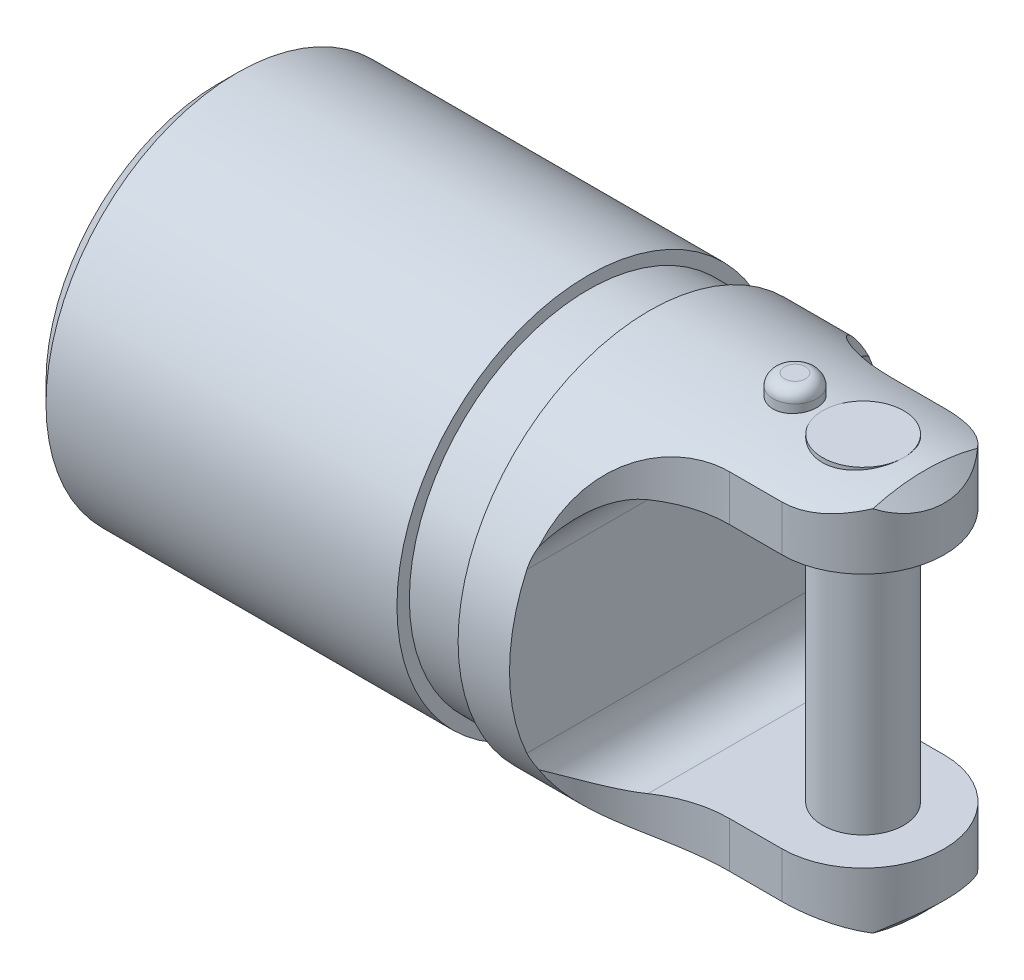
from build123d import *

# Parameters (mm, degrees)
SKETCH1_W               = 48.26
SKETCH1_H               = 12.7
CHAMFER1_SIZE           = 1.27
EXTRUDE1_DEPTH          = 47.473367709
EXTRUDE1_DEPTH_BACK     = 47.473367709
SKETCH4_R               = 6.35
EXTRUDE4_DEPTH          = 30.1625
EXTRUDE3_DEPTH          = 47.473367764
EXTRUDE3_DEPTH_BACK     = 47.473367764
EXTRUDE6_DEPTH          = 47.473367764
EXTRUDE6_DEPTH_BACK     = 47.473367764
SKETCH6_R               = 2.69875
SKETCH21_R              = 1.4605
BOSS_EXTRUDE1_DEPTH     = 13.97
FILLET1_R               = 0.762
CUT_EXTRUDE3_DEPTH      = 47.836362066
CUT_EXTRUDE3_DEPTH_BACK = 47.836362066
SKETCH23_W              = 4.064
SKETCH23_H              = 0.8255
SKETCH14_R              = 2.69875
EXTRUDE14_DEPTH         = 12.7


with BuildPart() as part:
    # Sketch1 → Revolve1 (revolve)
    with BuildSketch(Plane(origin=(0, 0, 0), x_dir=(1, 0, 0), z_dir=(0, 1, 0)), mode=Mode.PRIVATE) as revolve1_sk:
        with Locations((-18.7325, 6.35)):
            Rectangle(SKETCH1_W, SKETCH1_H)
    revolve(revolve1_sk.sketch.rotate(Axis((-42.8625, 0, 0), (1, 0, 0)), 180), axis=Axis((-42.8625, 0, 0), (1, 0, 0)))

    # Chamfer1
    chamfer1_edges = [part.edges().sort_by_distance(p)[0] for p in [
        (5.3975, 0, -12.7),
        (-42.8625, 0, -12.7),
    ]]
    chamfer(chamfer1_edges, length=CHAMFER1_SIZE)

    # Sketch2 → Extrude1 (cut, two sides: drawn at the far end of the back side and taken through both)
    with BuildSketch(Plane(origin=(0, 0, 0), x_dir=(1, 0, 0), z_dir=(0, 1, 0)).offset(-EXTRUDE1_DEPTH_BACK)):
        with BuildLine():
            Line((-10.795, 12.7), (10.795, 12.7))
            Line((10.795, 12.7), (10.795, -12.7))
            Line((10.795, -12.7), (-10.795, -12.7))
            ThreePointArc((-10.795, -12.7), (-8.65614727, -7.53635273), (-3.4925, -5.3975))
            Line((-3.4925, -5.3975), (0, -5.3975))
            ThreePointArc((0, -5.3975), (5.3975, 0), (0, 5.3975))
            Line((0, 5.3975), (-3.4925, 5.3975))
            ThreePointArc((-3.4925, 5.3975), (-8.65614727, 7.53635273), (-10.795, 12.7))
        make_face()
    extrude(amount=EXTRUDE1_DEPTH + EXTRUDE1_DEPTH_BACK, mode=Mode.SUBTRACT)

    # Sketch4 → Extrude4 (cut)
    with BuildSketch(Plane.ZY.offset(42.8625)):
        Circle(SKETCH4_R)
    extrude(amount=-EXTRUDE4_DEPTH, mode=Mode.SUBTRACT)

    # Sketch3 → Extrude3 (cut, two sides: drawn at the far end of the back side and taken through both)
    with BuildSketch(Plane.XY.offset(-EXTRUDE3_DEPTH_BACK)):
        with BuildLine():
            Line((-7.62, 8.4582), (10.795, 8.4582))
            Line((10.795, 8.4582), (10.795, -8.4582))
            Line((10.795, -8.4582), (-7.62, -8.4582))
            ThreePointArc((-7.62, -8.4582), (-9.86506403, -7.52826403), (-10.795, -5.2832))
            Line((-10.795, -5.2832), (-10.795, 5.2832))
            ThreePointArc((-10.795, 5.2832), (-9.86506403, 7.52826403), (-7.62, 8.4582))
        make_face()
    extrude(amount=EXTRUDE3_DEPTH + EXTRUDE3_DEPTH_BACK, mode=Mode.SUBTRACT)

    # Sketch6 → Extrude6 (cut, two sides: drawn at the far end of the back side and taken through both)
    with BuildSketch(Plane(origin=(0, 0, 0), x_dir=(1, 0, 0), z_dir=(0, 1, 0)).offset(-EXTRUDE6_DEPTH_BACK)):
        with Locations(Location((0, 0, 0), (0, 0, 270))):
            Circle(SKETCH6_R)
    extrude(amount=EXTRUDE6_DEPTH + EXTRUDE6_DEPTH_BACK, mode=Mode.SUBTRACT)

    # Sketch21 → Boss-Extrude1 (add, symmetric)
    with BuildSketch(Plane.XZ):
        with Locations((-4.524375, 0)):
            Circle(SKETCH21_R)
    extrude(amount=BOSS_EXTRUDE1_DEPTH, both=True)

    # Fillet1
    fillet1_edges = [part.edges().sort_by_distance(p)[0] for p in [
        (-5.984875, 13.97, 0),
        (-5.984875, -13.97, 0),
    ]]
    fillet(fillet1_edges, radius=FILLET1_R)

    # Sketch22 → Cut-Extrude3 (cut, two sides: drawn at the far end of the back side and taken through both)
    with BuildSketch(Plane.XY.offset(-CUT_EXTRUDE3_DEPTH_BACK)):
        with BuildLine():
            Line((10.795, 8.4582), (-7.62, 8.4582))
            ThreePointArc((-7.62, 8.4582), (-9.86506403, 7.52826403), (-10.795, 5.2832))
            Line((-10.795, 5.2832), (-10.795, -5.2832))
            ThreePointArc((-10.795, -5.2832), (-9.86506403, -7.52826403), (-7.62, -8.4582))
            Line((-7.62, -8.4582), (10.795, -8.4582))
            Line((10.795, -8.4582), (10.795, 8.4582))
        make_face()
    extrude(amount=CUT_EXTRUDE3_DEPTH + CUT_EXTRUDE3_DEPTH_BACK, mode=Mode.SUBTRACT)

    # Sketch23 → Cut-Revolve1 (revolve, cut)
    with BuildSketch(Plane(origin=(0, 0, 0), x_dir=(1, 0, 0), z_dir=(0, 1, 0))):
        with Locations((-16.2433, -12.28725)):
            Rectangle(SKETCH23_W, SKETCH23_H)
    revolve(axis=Axis((-42.8625, 0, 0), (1, 0, 0)), mode=Mode.SUBTRACT)


with BuildPart() as body_2:
    # Sketch14 → Extrude14 (new, symmetric)
    with BuildSketch(Plane(origin=(0, 0, 0), x_dir=(1, 0, 0), z_dir=(0, 1, 0))):
        with Locations(Location((0, 0, 0), (0, 0, 270))):
            Circle(SKETCH14_R)
    extrude(amount=EXTRUDE14_DEPTH, both=True)


solid = Compound([part.part, body_2.part])
